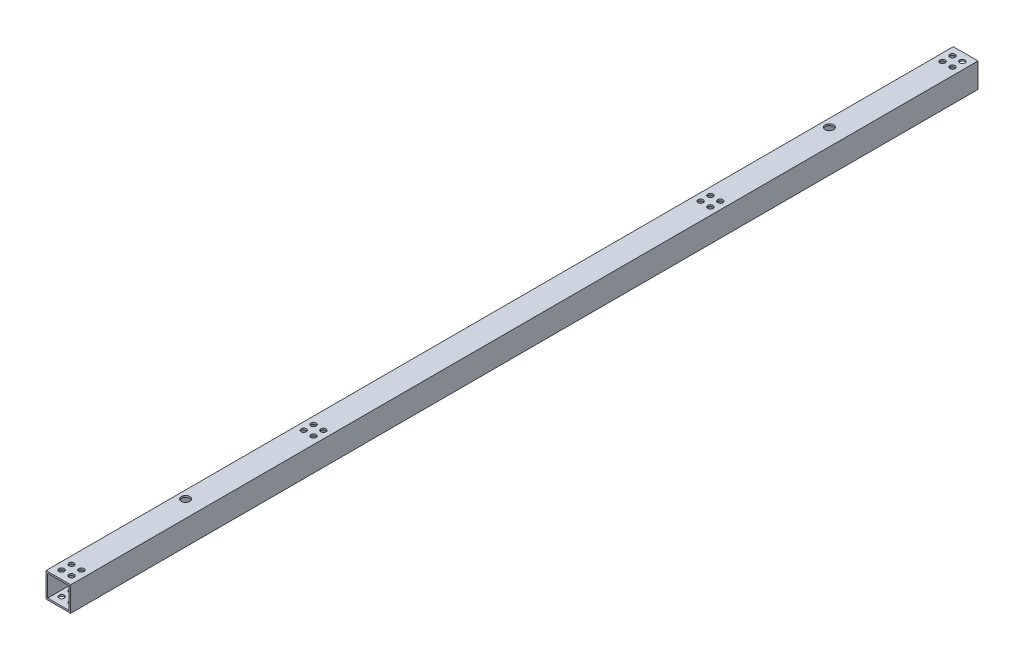
from build123d import *

# Parameters (mm, degrees)
SKETCH_1_W          = 15
SKETCH_1_H          = 15
SKETCH_1_W_2        = 13
SKETCH_1_H_2        = 13
EXTRUDE_1_DEPTH     = 551
SKETCH_2_R          = 1.6
SKETCH_2_R_2        = 2.6
CUT_EXTRUDE_1_DEPTH = 552.408197255


with BuildPart() as part:
    # 草图1 → 拉伸-薄壁1 (new body)
    with BuildSketch(Plane.XY):
        with Locations((7.5, -7.5)):
            Rectangle(SKETCH_1_W, SKETCH_1_H)
        with Locations((7.5, -7.5)):
            Rectangle(SKETCH_1_W_2, SKETCH_1_H_2, mode=Mode.SUBTRACT)
    extrude(amount=EXTRUDE_1_DEPTH)

    # 草图2 → 切除-拉伸1 (cut, through all)
    with BuildSketch(Plane(origin=(0, 0, 0), x_dir=(1, 0, 0), z_dir=(0, 1, 0))):
        with Locations(Location((4.5, -5, 0), (0, 0, 270))):
            Circle(SKETCH_2_R)
        with Locations(Location((10.5, -5, 0), (0, 0, 90))):
            Circle(SKETCH_2_R)
        with Locations(Location((10.5, -11, 0), (0, 0, 270))):
            Circle(SKETCH_2_R)
        with Locations(Location((4.5, -11, 0), (0, 0, 90))):
            Circle(SKETCH_2_R)
        with Locations(Location((4.5, -540, 0), (0, 0, 270))):
            Circle(SKETCH_2_R)
        with Locations(Location((10.5, -540, 0), (0, 0, 90))):
            Circle(SKETCH_2_R)
        with Locations(Location((10.5, -546, 0), (0, 0, 270))):
            Circle(SKETCH_2_R)
        with Locations(Location((4.5, -546, 0), (0, 0, 90))):
            Circle(SKETCH_2_R)
        with Locations(Location((4.75, -80, 0), (0, 0, 270))):
            Circle(SKETCH_2_R_2)
        with Locations(Location((4.5, -152, 0), (0, 0, 270))):
            Circle(SKETCH_2_R)
        with Locations(Location((10.5, -152, 0), (0, 0, 90))):
            Circle(SKETCH_2_R)
        with Locations(Location((10.5, -158, 0), (0, 0, 270))):
            Circle(SKETCH_2_R)
        with Locations(Location((4.5, -158, 0), (0, 0, 90))):
            Circle(SKETCH_2_R)
        with Locations(Location((4.75, -471, 0), (0, 0, 90))):
            Circle(SKETCH_2_R_2)
        with Locations(Location((4.5, -393, 0), (0, 0, 270))):
            Circle(SKETCH_2_R)
        with Locations(Location((10.5, -393, 0), (0, 0, 90))):
            Circle(SKETCH_2_R)
        with Locations(Location((10.5, -399, 0), (0, 0, 270))):
            Circle(SKETCH_2_R)
        with Locations(Location((4.5, -399, 0), (0, 0, 90))):
            Circle(SKETCH_2_R)
    extrude(amount=-CUT_EXTRUDE_1_DEPTH, mode=Mode.SUBTRACT)


solid = part.part
